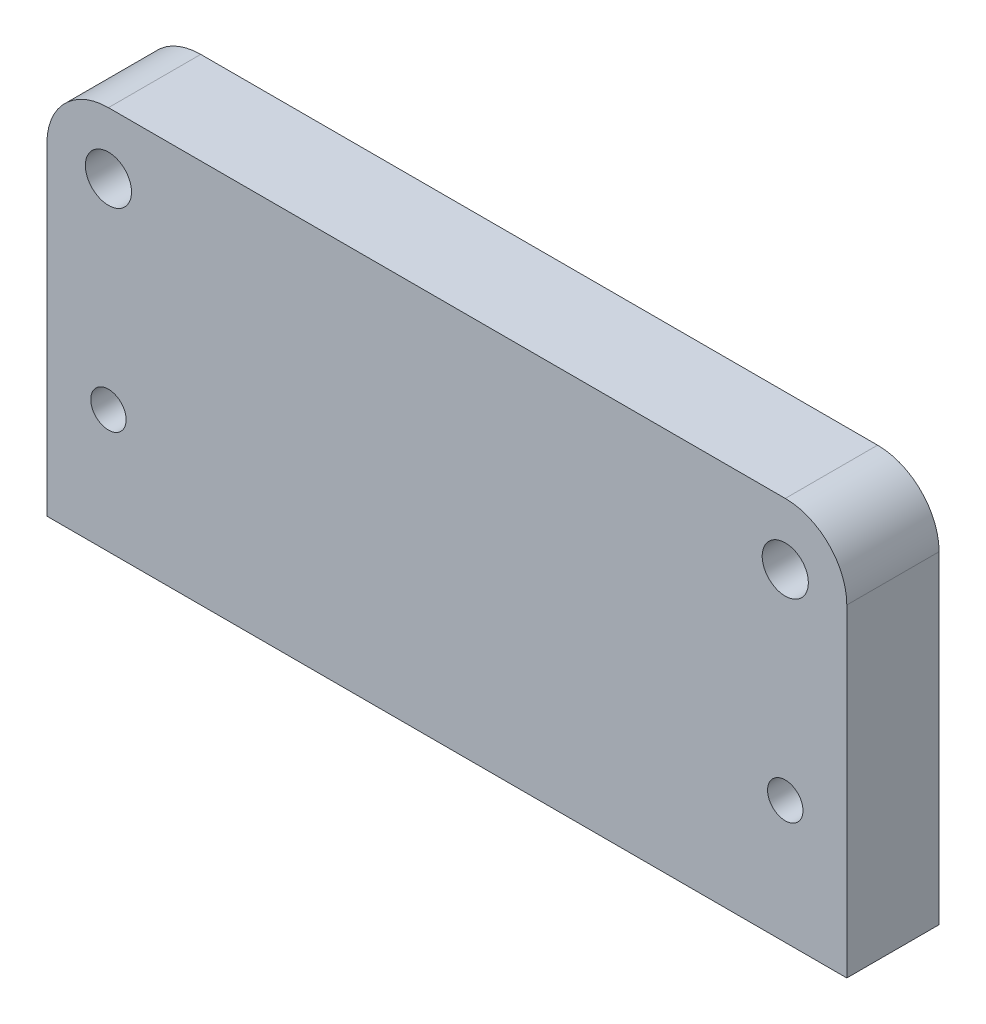
from build123d import *

# Parameters (mm, degrees)
SKETCH1_R           = 1.5
SKETCH1_R_2         = 1.15
BOSS_EXTRUDE1_DEPTH = 6


with BuildPart() as part:
    # Sketch1 → Boss-Extrude1 (new body)
    with BuildSketch(Plane.XY):
        with BuildLine():
            Line((0, 0), (52, 0))
            Line((52, 0), (52, 21))
            ThreePointArc((52, 21), (50.828427125, 23.828427125), (48, 25))
            Line((48, 25), (4, 25))
            ThreePointArc((4, 25), (1.171572875, 23.828427125), (0, 21))
            Line((0, 21), (0, 0))
        make_face()
        with Locations((4, 21)):
            Circle(SKETCH1_R, mode=Mode.SUBTRACT)
        with Locations((48, 21)):
            Circle(SKETCH1_R, mode=Mode.SUBTRACT)
        with Locations((4, 8)):
            Circle(SKETCH1_R_2, mode=Mode.SUBTRACT)
        with Locations((48, 8)):
            Circle(SKETCH1_R_2, mode=Mode.SUBTRACT)
    extrude(amount=BOSS_EXTRUDE1_DEPTH)


solid = part.part
